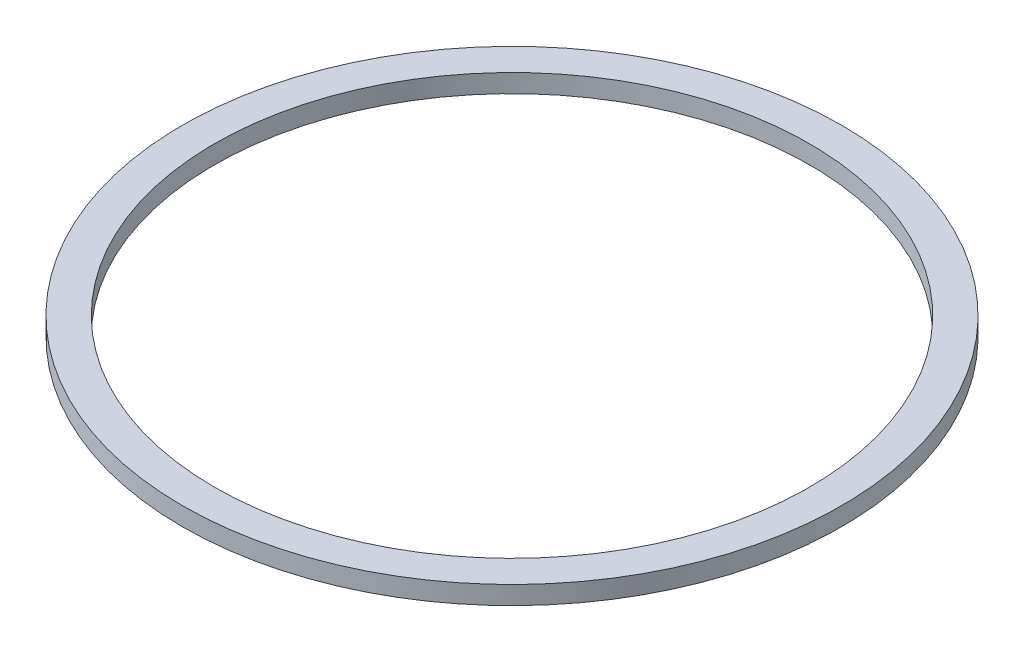
from build123d import *

# Parameters (mm, degrees)
SKETCH1_R           = 180
SKETCH1_R_2         = 162.5
BOSS_EXTRUDE1_DEPTH = 5


with BuildPart() as part:
    # Sketch1 → Boss-Extrude1 (new, symmetric)
    with BuildSketch(Plane(origin=(0, 0, 0), x_dir=(1, 0, 0), z_dir=(0, 1, 0))):
        with Locations(Location((0, 0, 0), (0, 0, 270))):
            Circle(SKETCH1_R)
        with Locations(Location((0, 0, 0), (0, 0, 270))):
            Circle(SKETCH1_R_2, mode=Mode.SUBTRACT)
    extrude(amount=BOSS_EXTRUDE1_DEPTH, both=True)


solid = part.part
